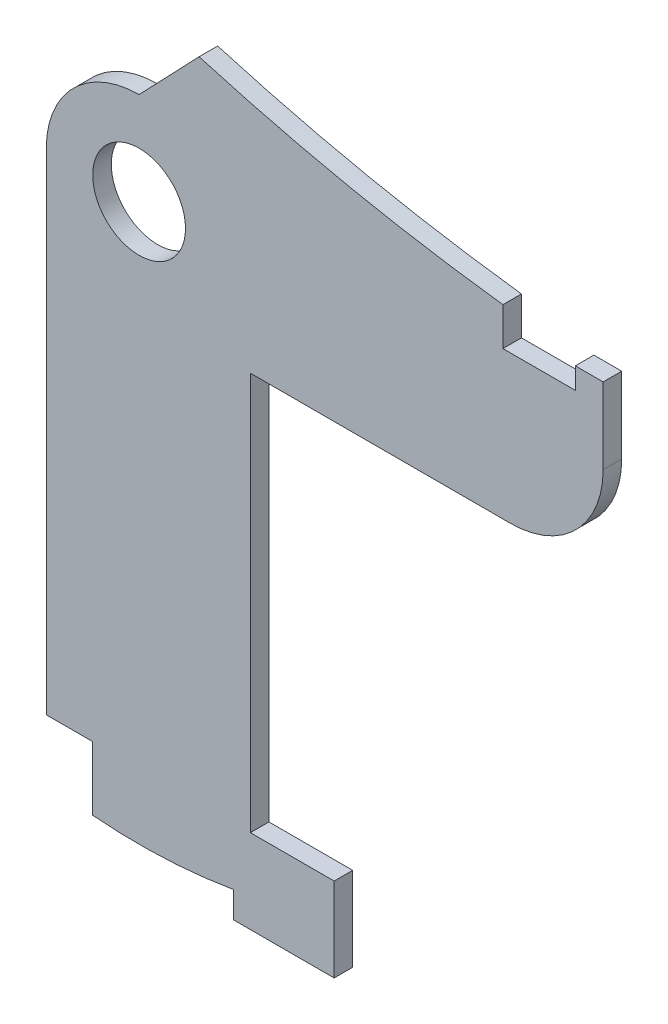
from build123d import *

# Parameters (mm, degrees)
SKETCH_1_R      = 2.5
EXTRUDE_1_DEPTH = 1


with BuildPart() as part:
    # 스케치1 → 보스-돌출1 (new body)
    with BuildSketch(Plane.XY):
        with BuildLine():
            Line((20.887065526, -4.904042543), (17.65515334, -8.287321674))
            ThreePointArc((17.65515334, -8.287321674), (14.119619434, -9.751787768), (12.65515334, -13.287321674))
            Line((12.65515334, -13.287321674), (12.65515334, -39.724999499))
            Line((12.65515334, -39.724999499), (15.15515334, -39.724999499))
            Line((15.15515334, -39.724999499), (15.15515334, -43.161796007))
            ThreePointArc((15.15515334, -43.161796007), (18.953651475, -43.238083254), (22.731294666, -42.833336733))
            Line((22.731294666, -42.833336733), (22.731294666, -44.249079054))
            Line((22.731294666, -44.249079054), (28.163405743, -44.249079054))
            Line((28.163405743, -44.249079054), (28.163405743, -39.724999499))
            Line((28.163405743, -39.724999499), (25.906714003, -39.724999499))
            Line((25.906714003, -39.724999499), (23.650022264, -39.724999499))
            Line((23.650022264, -39.724999499), (23.650022264, -18.287321674))
            Line((23.650022264, -18.287321674), (37.65515334, -18.287321674))
            ThreePointArc((37.65515334, -18.287321674), (41.190687246, -16.82285558), (42.65515334, -13.287321674))
            Line((42.65515334, -13.287321674), (42.65515334, -9.191405084))
            Line((42.65515334, -9.191405084), (41.15515334, -9.191405084))
            Line((41.15515334, -9.191405084), (41.15515334, -10.336593208))
            Line((41.15515334, -10.336593208), (37.25515334, -10.336593208))
            Line((37.25515334, -10.336593208), (37.25515334, -8.287321674))
            ThreePointArc((37.25515334, -8.287321674), (29.002533556, -6.92744781), (20.887065526, -4.904042543))
        make_face()
        with Locations((17.65515334, -13.287321674)):
            Circle(SKETCH_1_R, mode=Mode.SUBTRACT)
    extrude(amount=EXTRUDE_1_DEPTH)


solid = part.part
